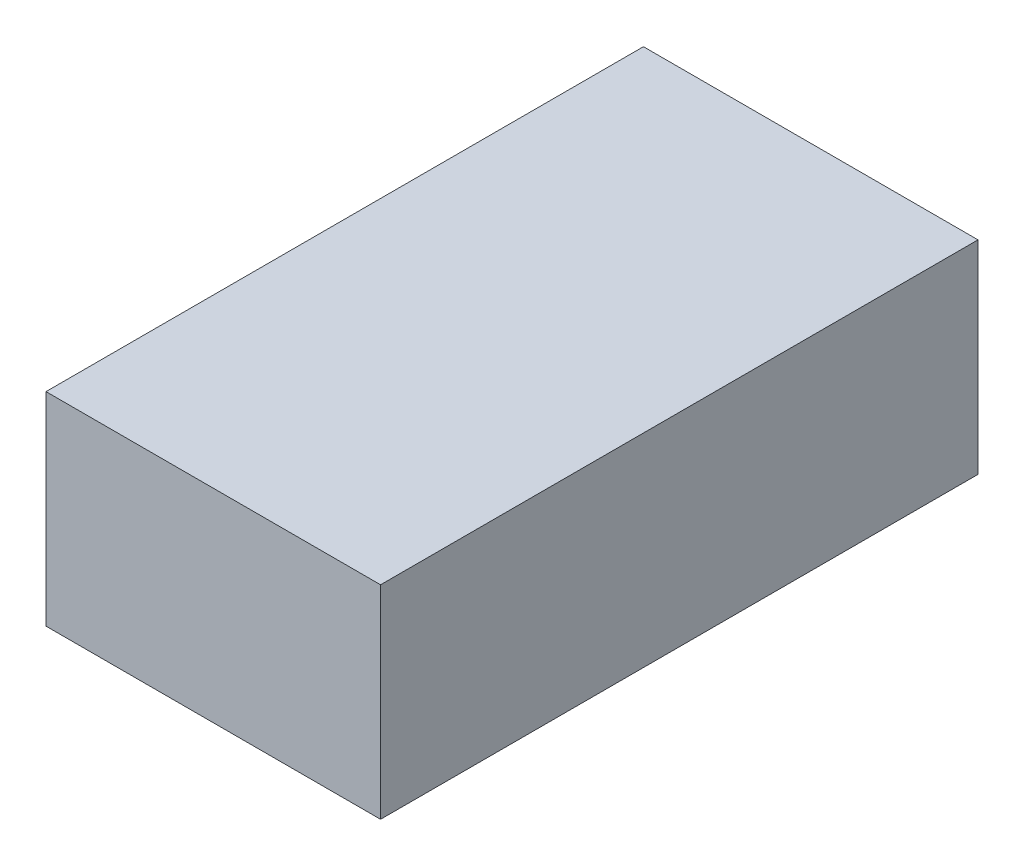
from build123d import *

# Parameters (mm, degrees)
ESBO_O1_W                = 28
ESBO_O1_H                = 50
RESSALTO_EXTRUS_O1_DEPTH = 17


with BuildPart() as part:
    # Esboço1 → Ressalto-extrusão1 (new body)
    with BuildSketch(Plane(origin=(0, 0, 0), x_dir=(1, 0, 0), z_dir=(0, 1, 0))):
        with Locations((14, 25)):
            Rectangle(ESBO_O1_W, ESBO_O1_H)
    extrude(amount=RESSALTO_EXTRUS_O1_DEPTH)


solid = part.part
